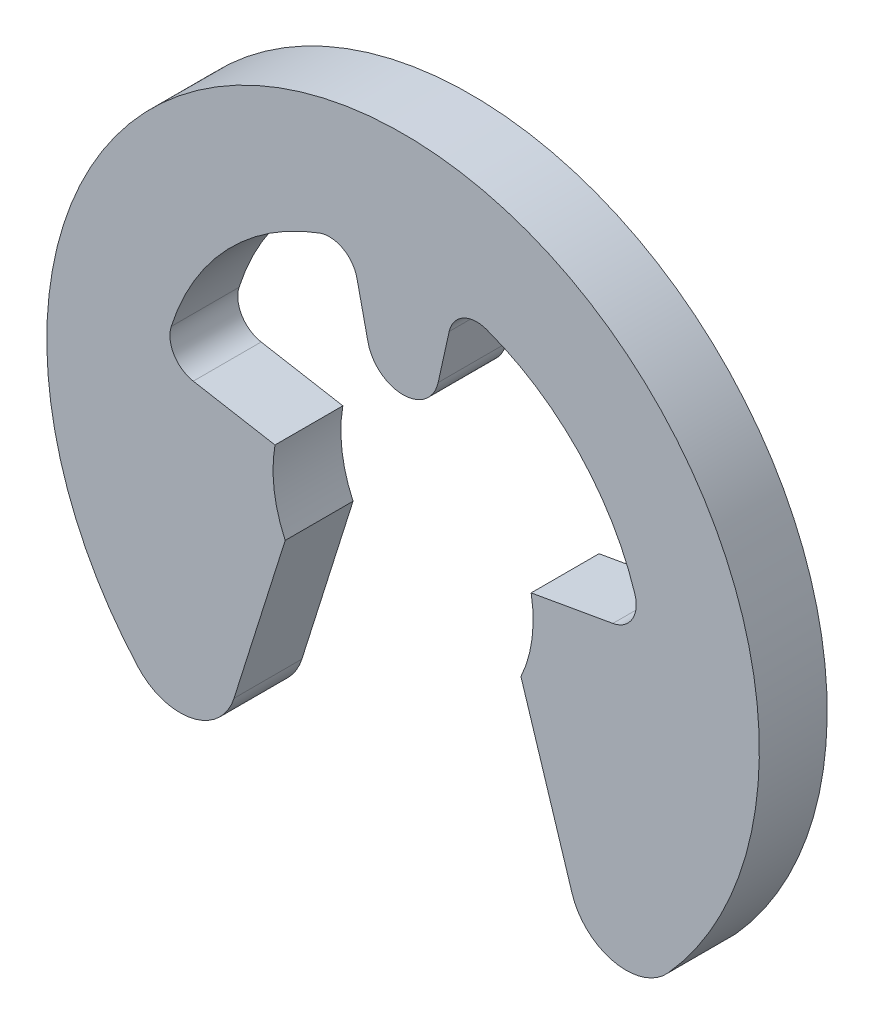
from build123d import *

# Parameters (mm, degrees)
BODY_DEPTH = 0.6


with BuildPart() as part:
    # BodySke → Body (new body)
    with BuildSketch(Plane.XY):
        with BuildLine():
            Line((1.132528916, 0.199695404), (1.854866514, 0.327063012))
            ThreePointArc((1.854866514, 0.327063012), (2.025251269, 0.443685134), (2.049803742, 0.648694549))
            ThreePointArc((2.049803742, 0.648694549), (1.553082518, 1.48675307), (0.737488319, 2.019557125))
            ThreePointArc((0.737488319, 2.019557125), (0.531603064, 2.003970405), (0.407659862, 1.838834804))
            Line((0.407659862, 1.838834804), (0.310129895, 1.398905556))
            ThreePointArc((0.310129895, 1.398905556), (0, 1.15), (-0.310129895, 1.398905556))
            Line((-0.310129895, 1.398905556), (-0.407659862, 1.838834804))
            ThreePointArc((-0.407659862, 1.838834804), (-0.531603064, 2.003970405), (-0.737488319, 2.019557125))
            ThreePointArc((-0.737488319, 2.019557125), (-1.553082518, 1.48675307), (-2.049803742, 0.648694549))
            ThreePointArc((-2.049803742, 0.648694549), (-2.025251269, 0.443685134), (-1.854866514, 0.327063012))
            Line((-1.854866514, 0.327063012), (-1.132528916, 0.199695404))
            ThreePointArc((-1.132528916, 0.199695404), (-1.140161591, -0.150105121), (-1.042253955, -0.486011001))
            Line((-1.042253955, -0.486011001), (-1.494720675, -1.921052099))
            ThreePointArc((-1.494720675, -1.921052099), (-1.865799916, -2.25938187), (-2.343575217, -2.104793387))
            ThreePointArc((-2.343575217, -2.104793387), (0, 3.15), (2.343575217, -2.104793387))
            ThreePointArc((2.343575217, -2.104793387), (1.865799916, -2.25938187), (1.494720675, -1.921052099))
            Line((1.494720675, -1.921052099), (1.042253955, -0.486011001))
            ThreePointArc((1.042253955, -0.486011001), (1.140161591, -0.150105121), (1.132528916, 0.199695404))
        make_face()
    extrude(amount=-BODY_DEPTH)


solid = part.part
